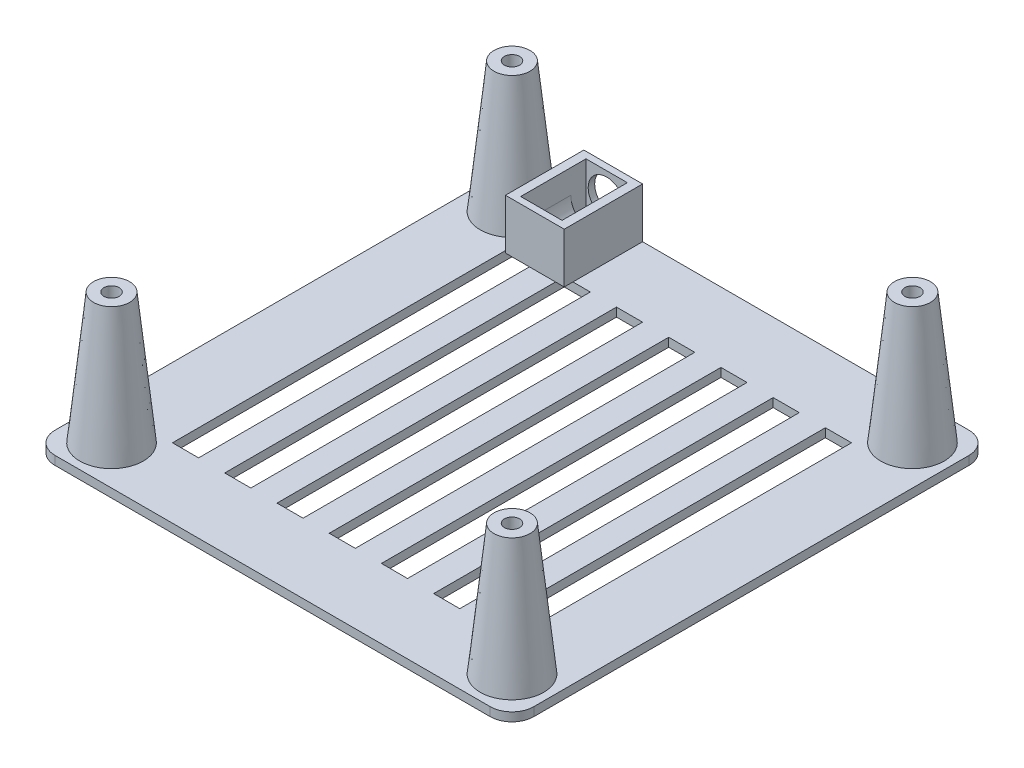
from build123d import *

# Parameters (mm, degrees)
SKETCH_1_R                = 1.75
EXTRUDE_1_DEPTH           = 2
EXTRUDE_1_2_DEPTH         = 2
EXTRUDE_1_3_DEPTH         = 2
SKETCH_1_W                = 110
SKETCH_1_H                = 110
SKETCH_1_R_2              = 3.5
EXTRUDE_1_4_DEPTH         = 2
SKETCH_1_3_R              = 7.5
EXTRUDE_2_DEPTH           = 32
EXTRUDE_2_DRAFT           = 6
EXTRUDE_2_PROFILE_2_DEPTH = 32
EXTRUDE_2_PROFILE_2_DRAFT = 6
EXTRUDE_2_PROFILE_3_DEPTH = 32
EXTRUDE_2_PROFILE_3_DRAFT = 6
EXTRUDE_2_PROFILE_4_DEPTH = 32
EXTRUDE_2_PROFILE_4_DRAFT = 6
SKETCH_1_4_R              = 1.75
CUT_EXTRUDE_1_DEPTH       = 32
FILLET_1_R                = 5
SKETCH_2_W                = 6
SKETCH_2_H                = 78
CUT_EXTRUDE_2_DEPTH       = 85.107074613
SKETCH_3_W                = 13.5
SKETCH_3_H                = 11.5
EXTRUDE_6_DEPTH           = 18
CUT_EXTRUDE_START         = -1.5
SKETCH_3_5_R              = 4.25
CUT_EXTRUDE_4_DEPTH       = 3.5
SKETCH_3_6_R              = 4.25
CUT_EXTRUDE_5_DEPTH       = 15
SKETCH_1_5_R              = 3.5
SKETCH_1_5_R_2            = 1.75
CUT_EXTRUDE_6_DEPTH       = 25
SKETCH_3_7_R              = 4.25
CUT_EXTRUDE_7_DEPTH       = 16.5


with BuildPart() as part:
    # 草图1 → 凸台-拉伸1 (new body)
    with BuildSketch(Plane(origin=(0, 0, 0), x_dir=(1, 0, 0), z_dir=(0, 1, 0))):
        with Locations(Location((46, -46, 0), (0, 0, 270))):
            Circle(SKETCH_1_R)
    extrude(amount=EXTRUDE_1_DEPTH)


with BuildPart() as body_2:
    # 草图1 → Extrude 1 2 (new body)
    with BuildSketch(Plane(origin=(0, 0, 0), x_dir=(1, 0, 0), z_dir=(0, 1, 0))):
        with Locations(Location((46, 46, 0), (0, 0, 270))):
            Circle(SKETCH_1_R)
    extrude(amount=EXTRUDE_1_2_DEPTH)


with BuildPart() as body_3:
    # 草图1 → Extrude 1 3 (new body)
    with BuildSketch(Plane(origin=(0, 0, 0), x_dir=(1, 0, 0), z_dir=(0, 1, 0))):
        with Locations(Location((-46, 46, 0), (0, 0, 90))):
            Circle(SKETCH_1_R)
    extrude(amount=EXTRUDE_1_3_DEPTH)


with BuildPart() as body_4:
    # 草图1 → Extrude 1 4 (new body)
    with BuildSketch(Plane(origin=(0, 0, 0), x_dir=(1, 0, 0), z_dir=(0, 1, 0))):
        Rectangle(SKETCH_1_W, SKETCH_1_H)
        with Locations(Location((-46, 46, 0), (0, 0, 270))):
            Circle(SKETCH_1_R_2, mode=Mode.SUBTRACT)
        with Locations(Location((46, -46, 0), (0, 0, 270))):
            Circle(SKETCH_1_R_2, mode=Mode.SUBTRACT)
        with Locations(Location((46, 46, 0), (0, 0, 270))):
            Circle(SKETCH_1_R_2, mode=Mode.SUBTRACT)
    extrude(amount=EXTRUDE_1_4_DEPTH)


with BuildPart() as extrude_2_tool:
    # 草图1<3> → 凸台-拉伸2 (with draft: the straight prism first)
    with BuildSketch(Plane(origin=(0, 0, 0), x_dir=(1, 0, 0), z_dir=(0, 1, 0))):
        with Locations((-46, -46)):
            Circle(SKETCH_1_3_R)
    extrude(amount=EXTRUDE_2_DEPTH)
    # 凸台-拉伸2: the draft: its side faces are tilted about the plane it starts from
    extrude_2_sides = [extrude_2_tool.faces().sort_by_distance(p)[0] for p in [
        (-53.5, 16, 46),
    ]]
    draft(extrude_2_sides, Plane(origin=(0, 0, 0), x_dir=(1, 0, 0), z_dir=(0, 1, 0)), EXTRUDE_2_DRAFT)


with BuildPart() as body_4_1:
    add(body_4.part)

    # 凸台-拉伸2: add extrude_2_tool
    add(extrude_2_tool.part)


with BuildPart() as extrude_2_profile_2_tool:
    # 草图1<3> → 凸台-拉伸2 profile 2 (with draft: the straight prism first)
    with BuildSketch(Plane(origin=(0, 0, 0), x_dir=(1, 0, 0), z_dir=(0, 1, 0))):
        with Locations((46, -46)):
            Circle(SKETCH_1_3_R)
    extrude(amount=EXTRUDE_2_PROFILE_2_DEPTH)
    # 凸台-拉伸2 profile 2: the draft: its side faces are tilted about the plane it starts from
    extrude_2_profile_2_sides = [extrude_2_profile_2_tool.faces().sort_by_distance(p)[0] for p in [
        (38.5, 16, 46),
    ]]
    draft(extrude_2_profile_2_sides, Plane(origin=(0, 0, 0), x_dir=(1, 0, 0), z_dir=(0, 1, 0)), EXTRUDE_2_PROFILE_2_DRAFT)


with BuildPart() as body_4_2:
    add(body_4_1.part)

    # 凸台-拉伸2 profile 2: add extrude_2_profile_2_tool
    add(extrude_2_profile_2_tool.part)


with BuildPart() as extrude_2_profile_3_tool:
    # 草图1<3> → 凸台-拉伸2 profile 3 (with draft: the straight prism first)
    with BuildSketch(Plane(origin=(0, 0, 0), x_dir=(1, 0, 0), z_dir=(0, 1, 0))):
        with Locations((46, 46)):
            Circle(SKETCH_1_3_R)
    extrude(amount=EXTRUDE_2_PROFILE_3_DEPTH)
    # 凸台-拉伸2 profile 3: the draft: its side faces are tilted about the plane it starts from
    extrude_2_profile_3_sides = [extrude_2_profile_3_tool.faces().sort_by_distance(p)[0] for p in [
        (38.5, 16, -46),
    ]]
    draft(extrude_2_profile_3_sides, Plane(origin=(0, 0, 0), x_dir=(1, 0, 0), z_dir=(0, 1, 0)), EXTRUDE_2_PROFILE_3_DRAFT)


with BuildPart() as body_4_3:
    add(body_4_2.part)

    # 凸台-拉伸2 profile 3: add extrude_2_profile_3_tool
    add(extrude_2_profile_3_tool.part)


with BuildPart() as extrude_2_profile_4_tool:
    # 草图1<3> → 凸台-拉伸2 profile 4 (with draft: the straight prism first)
    with BuildSketch(Plane(origin=(0, 0, 0), x_dir=(1, 0, 0), z_dir=(0, 1, 0))):
        with Locations((-46, 46)):
            Circle(SKETCH_1_3_R)
    extrude(amount=EXTRUDE_2_PROFILE_4_DEPTH)
    # 凸台-拉伸2 profile 4: the draft: its side faces are tilted about the plane it starts from
    extrude_2_profile_4_sides = [extrude_2_profile_4_tool.faces().sort_by_distance(p)[0] for p in [
        (-53.5, 16, -46),
    ]]
    draft(extrude_2_profile_4_sides, Plane(origin=(0, 0, 0), x_dir=(1, 0, 0), z_dir=(0, 1, 0)), EXTRUDE_2_PROFILE_4_DRAFT)


with BuildPart() as body_4_4:
    add(body_4_3.part)

    # 凸台-拉伸2 profile 4: add extrude_2_profile_4_tool
    add(extrude_2_profile_4_tool.part)


with BuildPart() as cut_extrude_1_tool:
    # 草图1<4> → 切除-拉伸1 (new body)
    with BuildSketch(Plane(origin=(0, 0, 0), x_dir=(1, 0, 0), z_dir=(0, 1, 0))):
        with Locations(Location((-46, 46, 0), (0, 0, 90))):
            Circle(SKETCH_1_4_R)
        with Locations(Location((-46, -46, 0), (0, 0, 270))):
            Circle(SKETCH_1_4_R)
        with Locations(Location((46, -46, 0), (0, 0, 90))):
            Circle(SKETCH_1_4_R)
        with Locations(Location((46, 46, 0), (0, 0, 270))):
            Circle(SKETCH_1_4_R)
    extrude(amount=CUT_EXTRUDE_1_DEPTH)


with BuildPart() as part_1:
    add(part.part)

    # 切除-拉伸1: cut by cut_extrude_1_tool
    add(cut_extrude_1_tool.part, mode=Mode.SUBTRACT)


with BuildPart() as body_2_1:
    add(body_2.part)

    # 切除-拉伸1: cut by cut_extrude_1_tool
    add(cut_extrude_1_tool.part, mode=Mode.SUBTRACT)


with BuildPart() as body_3_1:
    add(body_3.part)

    # 切除-拉伸1: cut by cut_extrude_1_tool
    add(cut_extrude_1_tool.part, mode=Mode.SUBTRACT)


with BuildPart() as body_4_5:
    add(body_4_4.part)

    # 切除-拉伸1: cut by cut_extrude_1_tool
    add(cut_extrude_1_tool.part, mode=Mode.SUBTRACT)

    # 圆角1
    fillet_1_edges = [body_4_5.edges().sort_by_distance(p)[0] for p in [
        (55, 1, 55),
        (-55, 1, 55),
        (-55, 1, -55),
        (55, 1, -55),
    ]]
    fillet(fillet_1_edges, radius=FILLET_1_R)

    # 草图2 → 切除-拉伸2 (cut, through all)
    with BuildSketch(Plane.XZ):
        with Locations((-36, 0)):
            Rectangle(SKETCH_2_W, SKETCH_2_H)
        with Locations((-24, 0)):
            Rectangle(SKETCH_2_W, SKETCH_2_H)
        with Locations((-12, 0)):
            Rectangle(SKETCH_2_W, SKETCH_2_H)
        Rectangle(SKETCH_2_W, SKETCH_2_H)
        with Locations((12, 0)):
            Rectangle(SKETCH_2_W, SKETCH_2_H)
        with Locations((24, 0)):
            Rectangle(SKETCH_2_W, SKETCH_2_H)
        with Locations((36, 0)):
            Rectangle(SKETCH_2_W, SKETCH_2_H)
    extrude(amount=-CUT_EXTRUDE_2_DEPTH, mode=Mode.SUBTRACT)

    # 草图1<5> → 切除-拉伸6 (cut)
    # profile 1 of 4: a face of its own
    with BuildSketch(Plane(origin=(0, 0, 0), x_dir=(1, 0, 0), z_dir=(0, 1, 0))):
        with Locations(Location((-46, -46, 0), (0, 0, 270))):
            Circle(SKETCH_1_5_R)
        with Locations(Location((-46, -46, 0), (0, 0, 270))):
            Circle(SKETCH_1_5_R_2, mode=Mode.SUBTRACT)
    # profile 2 of 4: a face of its own
    with BuildSketch(Plane(origin=(0, 0, 0), x_dir=(1, 0, 0), z_dir=(0, 1, 0))):
        with Locations(Location((46, -46, 0), (0, 0, 90))):
            Circle(SKETCH_1_5_R)
    # profile 3 of 4: a face of its own
    with BuildSketch(Plane(origin=(0, 0, 0), x_dir=(1, 0, 0), z_dir=(0, 1, 0))):
        with Locations(Location((-46, 46, 0), (0, 0, 90))):
            Circle(SKETCH_1_5_R)
    # profile 4 of 4: a face of its own
    with BuildSketch(Plane(origin=(0, 0, 0), x_dir=(1, 0, 0), z_dir=(0, 1, 0))):
        with Locations(Location((46, 46, 0), (0, 0, 270))):
            Circle(SKETCH_1_5_R)
    extrude(amount=CUT_EXTRUDE_6_DEPTH, mode=Mode.SUBTRACT)


with BuildPart() as body_2_2:
    # 草图3 → 凸台-拉伸6 (new body)
    with BuildSketch(Plane(origin=(0, 0, -55), x_dir=(-1, 0, 0), z_dir=(0, 0, -1))):
        with Locations((31.75, 7.75)):
            Rectangle(SKETCH_3_W, SKETCH_3_H)
    extrude(amount=-EXTRUDE_6_DEPTH)

    # 草图3<5> → 切除-拉伸4 (cut)
    # profile 1 of 2: a face of its own
    with BuildSketch(Plane(origin=(0, 0, -55), x_dir=(-1, 0, 0), z_dir=(0, 0, -1)).offset(CUT_EXTRUDE_START)):
        with BuildLine():
            ThreePointArc((27, 8), (31.75, 3.25), (36.5, 8))
            Line((36.5, 8), (36.5, 13.5))
            Line((36.5, 13.5), (27, 13.5))
            Line((27, 13.5), (27, 8))
        make_face()
        with Locations((31.75, 8)):
            Circle(SKETCH_3_5_R, mode=Mode.SUBTRACT)
    # profile 2 of 2: a face of its own
    with BuildSketch(Plane(origin=(0, 0, -55), x_dir=(-1, 0, 0), z_dir=(0, 0, -1)).offset(CUT_EXTRUDE_START)):
        with BuildLine():
            Line((27, 2), (36.5, 2))
            Line((36.5, 2), (36.5, 8))
            ThreePointArc((36.5, 8), (31.75, 3.25), (27, 8))
            Line((27, 8), (27, 2))
        make_face()
    extrude(amount=-CUT_EXTRUDE_4_DEPTH, mode=Mode.SUBTRACT)

    # 草图3<6> → 切除-拉伸5 (cut)
    with BuildSketch(Plane(origin=(0, 0, -55), x_dir=(-1, 0, 0), z_dir=(0, 0, -1)).offset(CUT_EXTRUDE_START)):
        with BuildLine():
            ThreePointArc((27, 8), (31.75, 3.25), (36.5, 8))
            Line((36.5, 8), (36.5, 13.5))
            Line((36.5, 13.5), (27, 13.5))
            Line((27, 13.5), (27, 8))
        make_face()
        with Locations((31.75, 8)):
            Circle(SKETCH_3_6_R, mode=Mode.SUBTRACT)
    extrude(amount=-CUT_EXTRUDE_5_DEPTH, mode=Mode.SUBTRACT)

    # 草图3<7> → 切除-拉伸7 (cut)
    with BuildSketch(Plane(origin=(0, 0, -55), x_dir=(-1, 0, 0), z_dir=(0, 0, -1))):
        with Locations((31.75, 8)):
            Circle(SKETCH_3_7_R)
    extrude(amount=-CUT_EXTRUDE_7_DEPTH, mode=Mode.SUBTRACT)


solid = Compound([body_4_5.part, body_2_2.part])
